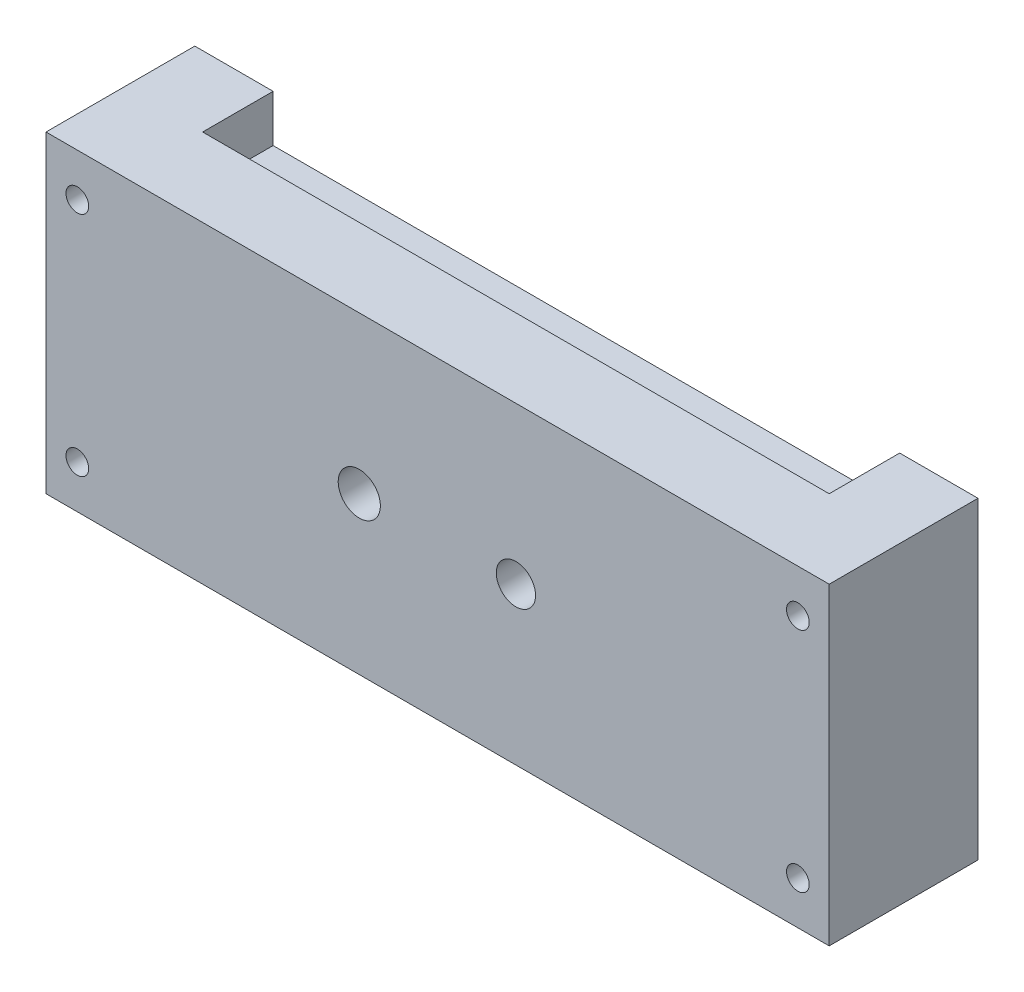
from build123d import *

# Parameters (mm, degrees)
SKETCH1_W           = 100
SKETCH1_H           = 40
BOSS_EXTRUDE1_DEPTH = 38
CUT_EXTRUDE4_REACH  = 81.36
SKETCH4_R           = 1.45
SKETCH6_W           = 100
SKETCH6_H           = 19
CUT_EXTRUDE5_DEPTH  = 87.215210375
CUT_EXTRUDE12_DEPTH = 9
CUT_EXTRUDE13_REACH = 72.385
SKETCH18_R          = 2.506862912
SKETCH18_R_2        = 2.693115416
SKETCH19_R          = 6.477
SKETCH19_R_2        = 4.572
CUT_EXTRUDE14_DEPTH = 0.79375
SKETCH21_W          = 10
SKETCH21_H          = 15
CUT_EXTRUDE15_DEPTH = 9
SKETCH22_W          = 4
SKETCH22_H          = 2.5
CUT_EXTRUDE16_DEPTH = 90
SKETCH23_W          = 80
SKETCH23_H          = 6
CUT_EXTRUDE17_DEPTH = 9


with BuildPart() as part:
    # Sketch1 → Boss-Extrude1 (new body)
    with BuildSketch(Plane.XY):
        with Locations((16.25, 1.5625)):
            Rectangle(SKETCH1_W, SKETCH1_H)
    extrude(amount=BOSS_EXTRUDE1_DEPTH)

    # Sketch4 → Cut-Extrude4 (cut, up to next)
    with BuildSketch(Plane(origin=(0, 0, 0), x_dir=(-1, 0, 0), z_dir=(0, 0, -1)), mode=Mode.PRIVATE) as cut_extrude4_sk1:
        with Locations((-62.25, 16.0625)):
            Circle(SKETCH4_R)
    cut_extrude4_tool1 = extrude(cut_extrude4_sk1.sketch, amount=-CUT_EXTRUDE4_REACH, mode=Mode.PRIVATE) & part.part
    # Sketch4 → Cut-Extrude4 (cut, up to next)
    with BuildSketch(Plane(origin=(0, 0, 0), x_dir=(-1, 0, 0), z_dir=(0, 0, -1)), mode=Mode.PRIVATE) as cut_extrude4_sk2:
        with Locations((-62.25, -12.9375)):
            Circle(SKETCH4_R)
    cut_extrude4_tool2 = extrude(cut_extrude4_sk2.sketch, amount=-CUT_EXTRUDE4_REACH, mode=Mode.PRIVATE) & part.part
    # Sketch4 → Cut-Extrude4 (cut, up to next)
    with BuildSketch(Plane(origin=(0, 0, 0), x_dir=(-1, 0, 0), z_dir=(0, 0, -1)), mode=Mode.PRIVATE) as cut_extrude4_sk3:
        with Locations((29.75, 16.0625)):
            Circle(SKETCH4_R)
    cut_extrude4_tool3 = extrude(cut_extrude4_sk3.sketch, amount=-CUT_EXTRUDE4_REACH, mode=Mode.PRIVATE) & part.part
    # Sketch4 → Cut-Extrude4 (cut, up to next)
    with BuildSketch(Plane(origin=(0, 0, 0), x_dir=(-1, 0, 0), z_dir=(0, 0, -1)), mode=Mode.PRIVATE) as cut_extrude4_sk4:
        with Locations((29.75, -12.9375)):
            Circle(SKETCH4_R)
    cut_extrude4_tool4 = extrude(cut_extrude4_sk4.sketch, amount=-CUT_EXTRUDE4_REACH, mode=Mode.PRIVATE) & part.part
    add(cut_extrude4_tool1.solids().sort_by_distance((62.25, 16.0625, 0))[0], mode=Mode.SUBTRACT)
    add(cut_extrude4_tool2.solids().sort_by_distance((62.25, -12.9375, 0))[0], mode=Mode.SUBTRACT)
    add(cut_extrude4_tool3.solids().sort_by_distance((-29.75, 16.0625, 0))[0], mode=Mode.SUBTRACT)
    add(cut_extrude4_tool4.solids().sort_by_distance((-29.75, -12.9375, 0))[0], mode=Mode.SUBTRACT)

    # Sketch6 → Cut-Extrude5 (cut, through all)
    with BuildSketch(Plane(origin=(0, 21.5625, 0), x_dir=(1, 0, 0), z_dir=(0, 1, 0))):
        with Locations((16.25, -28.5)):
            Rectangle(SKETCH6_W, SKETCH6_H)
    extrude(amount=-CUT_EXTRUDE5_DEPTH, mode=Mode.SUBTRACT)

    # Sketch17 → Cut-Extrude12 (cut)
    with BuildSketch(Plane(origin=(0, 0, 0), x_dir=(-1, 0, 0), z_dir=(0, 0, -1))):
        with BuildLine():
            Line((-56.25, 9.0625), (23.75, 9.0625))
            ThreePointArc((23.75, 9.0625), (31.25, 1.5625), (23.75, -5.9375))
            Line((23.75, -5.9375), (-56.25, -5.9375))
            ThreePointArc((-56.25, -5.9375), (-63.75, 1.5625), (-56.25, 9.0625))
        make_face()
    extrude(amount=-CUT_EXTRUDE12_DEPTH, mode=Mode.SUBTRACT)

    # Sketch18 → Cut-Extrude13 (cut, up to next)
    with BuildSketch(Plane(origin=(0, 0, 9), x_dir=(-1, 0, 0), z_dir=(0, 0, -1)), mode=Mode.PRIVATE) as cut_extrude13_sk1:
        with Locations((-26.25, 1.5625)):
            Circle(SKETCH18_R)
    cut_extrude13_tool1 = extrude(cut_extrude13_sk1.sketch, amount=-CUT_EXTRUDE13_REACH, mode=Mode.PRIVATE) & part.part
    # Sketch18 → Cut-Extrude13 (cut, up to next)
    with BuildSketch(Plane(origin=(0, 0, 9), x_dir=(-1, 0, 0), z_dir=(0, 0, -1)), mode=Mode.PRIVATE) as cut_extrude13_sk2:
        with Locations((-6.25, 1.5625)):
            Circle(SKETCH18_R_2)
    cut_extrude13_tool2 = extrude(cut_extrude13_sk2.sketch, amount=-CUT_EXTRUDE13_REACH, mode=Mode.PRIVATE) & part.part
    add(cut_extrude13_tool1.solids().sort_by_distance((26.25, 1.5625, 9))[0], mode=Mode.SUBTRACT)
    add(cut_extrude13_tool2.solids().sort_by_distance((6.25, 1.5625, 9))[0], mode=Mode.SUBTRACT)

    # Sketch19 → Cut-Extrude14 (cut)
    # profile 1 of 2: a face of its own
    with BuildSketch(Plane(origin=(0, 0, 9), x_dir=(-1, 0, 0), z_dir=(0, 0, -1))):
        with Locations((-26.25, 1.5625)):
            Circle(SKETCH19_R)
        with Locations((-26.25, 1.5625)):
            Circle(SKETCH19_R_2, mode=Mode.SUBTRACT)
    # profile 2 of 2: a face of its own
    with BuildSketch(Plane(origin=(0, 0, 9), x_dir=(-1, 0, 0), z_dir=(0, 0, -1))):
        with Locations((-6.25, 1.5625)):
            Circle(SKETCH19_R)
        with Locations((-6.25, 1.5625)):
            Circle(SKETCH19_R_2, mode=Mode.SUBTRACT)
    extrude(amount=-CUT_EXTRUDE14_DEPTH, mode=Mode.SUBTRACT)

    # Sketch21 → Cut-Extrude15 (cut)
    with BuildSketch(Plane(origin=(0, 0, 0), x_dir=(-1, 0, 0), z_dir=(0, 0, -1))):
        with Locations((28.75, 1.5625)):
            Rectangle(SKETCH21_W, SKETCH21_H)
    extrude(amount=-CUT_EXTRUDE15_DEPTH, mode=Mode.SUBTRACT)

    # Sketch22 → Cut-Extrude16 (cut)
    with BuildSketch(Plane.ZY.offset(33.75)):
        with Locations((4, 10.3125)):
            Rectangle(SKETCH22_W, SKETCH22_H)
        with Locations((4, -7.1875)):
            Rectangle(SKETCH22_W, SKETCH22_H)
    extrude(amount=-CUT_EXTRUDE16_DEPTH, mode=Mode.SUBTRACT)

    # Sketch23 → Cut-Extrude17 (cut)
    with BuildSketch(Plane(origin=(0, 0, 0), x_dir=(-1, 0, 0), z_dir=(0, 0, -1))):
        with Locations((-16.25, 18.5625)):
            Rectangle(SKETCH23_W, SKETCH23_H)
        with Locations((-16.25, -15.4375)):
            Rectangle(SKETCH23_W, SKETCH23_H)
    extrude(amount=-CUT_EXTRUDE17_DEPTH, mode=Mode.SUBTRACT)


solid = part.part
